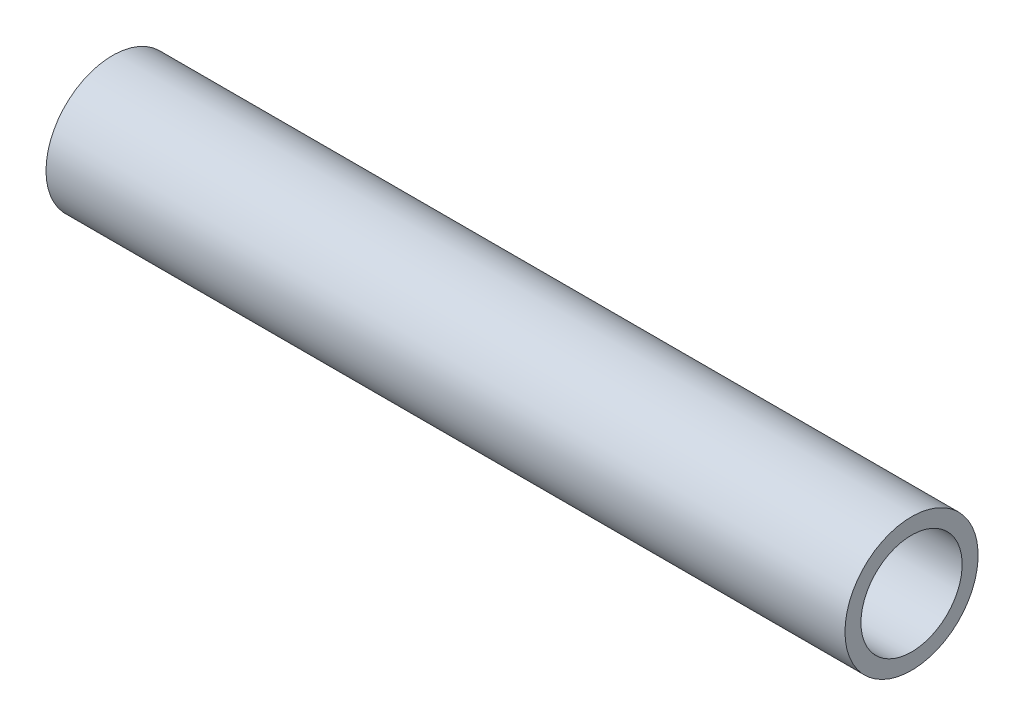
from build123d import *

# Parameters (mm, degrees)
SKETCH1_R           = 12.7
SKETCH1_R_2         = 9.652
BOSS_EXTRUDE1_DEPTH = 152.4


with BuildPart() as part:
    # Sketch1 → Boss-Extrude1 (new body)
    with BuildSketch(Plane(origin=(0, 0, 0), x_dir=(0, 0, -1), z_dir=(1, 0, 0))):
        with Locations(Location((0, 0, 0), (0, 0, 180))):
            Circle(SKETCH1_R)
        with Locations(Location((0, 0, 0), (0, 0, 180))):
            Circle(SKETCH1_R_2, mode=Mode.SUBTRACT)
    extrude(amount=BOSS_EXTRUDE1_DEPTH)


solid = part.part
